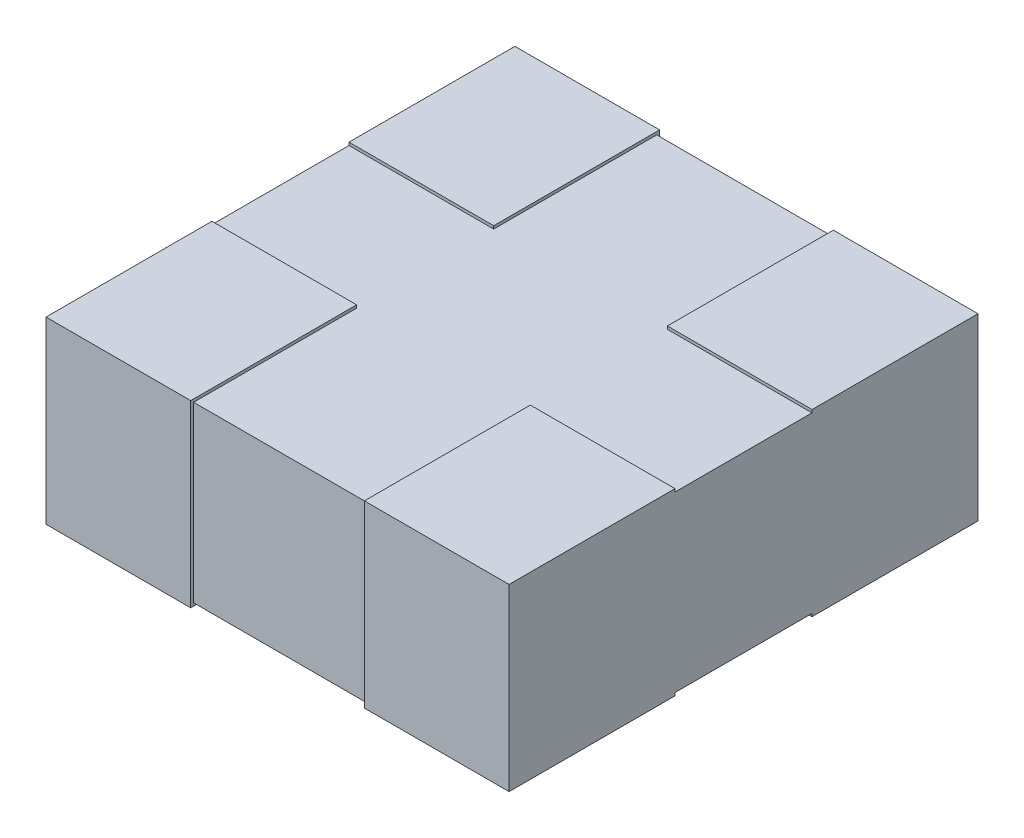
from build123d import *

# Parameters (mm, degrees)
SKETCH_1_W      = 1.6
SKETCH_1_H      = 1.6
EXTRUDE_1_DEPTH = 0.6
SKETCH_2_W      = 0.573263013
SKETCH_2_H      = 0.62
EXTRUDE_2_DEPTH = 0.5


with BuildPart() as part:
    # 草图1 → 凸台-拉伸1 (new body)
    with BuildSketch(Plane(origin=(0, 0, 0), x_dir=(1, 0, 0), z_dir=(0, 1, 0))):
        Rectangle(SKETCH_1_W, SKETCH_1_H)
    extrude(amount=EXTRUDE_1_DEPTH)

    # 草图2 → 凸台-拉伸2 (add)
    with BuildSketch(Plane.ZY.offset(0.8)):
        with Locations((0.523368494, 0.3)):
            Rectangle(SKETCH_2_W, SKETCH_2_H)
        with Locations((-0.523368494, 0.3)):
            Rectangle(SKETCH_2_W, SKETCH_2_H)
    extrude_2 = extrude(amount=-EXTRUDE_2_DEPTH)

    # 镜向1: 凸台-拉伸2 across plane
    add(extrude_2.mirror(Plane(origin=(0, 0, 0), x_dir=(0, 0, 1), z_dir=(1, 0, 0))))


solid = part.part
